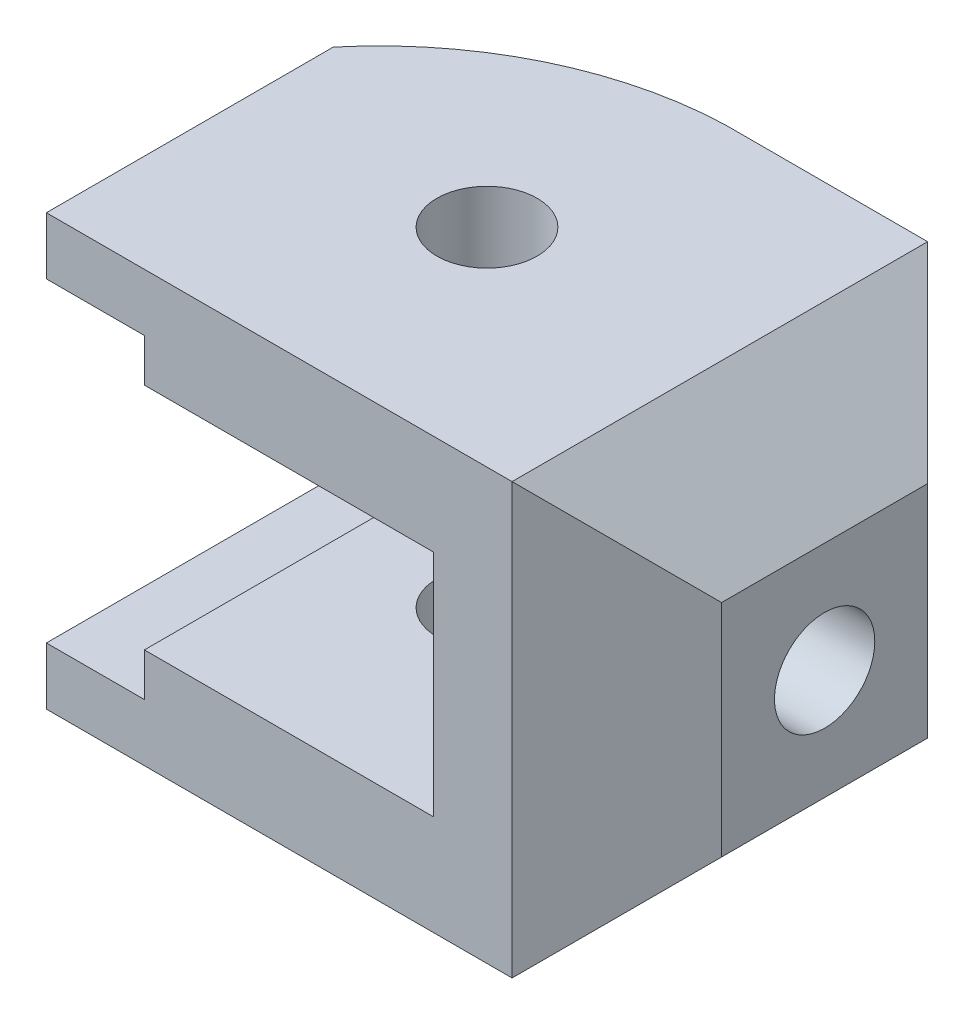
from build123d import *

# Parameters (mm, degrees)
BOSS_EXTRUDE1_DEPTH = 58
SKETCH5_R           = 7
CUT_EXTRUDE1_DEPTH  = 116.341103519
SKETCH7_R           = 7
CUT_EXTRUDE2_DEPTH  = 116.341103519
CUT_EXTRUDE3_DEPTH  = 116.341103519
CUT_EXTRUDE4_DEPTH  = 116.341103519


with BuildPart() as part:
    # Sketch1 → Boss-Extrude1 (new body)
    with BuildSketch(Plane.XY):
        Polygon((0, 0), (65, 0), (79.621417728, 14.621417728), (79.621417728, 45.378582272), (65, 60), (0, 60), (0, 52), (13.686014712, 52), (13.686014712, 46), (54, 46), (54, 14), (13.686014712, 14), (13.686014712, 8), (0, 8), align=None)
    extrude(amount=BOSS_EXTRUDE1_DEPTH)

    # Sketch5 → Cut-Extrude1 (cut, through all)
    with BuildSketch(Plane(origin=(79.621417728, 0, 0), x_dir=(0, 0, -1), z_dir=(1, 0, 0))):
        with Locations((-29, 30)):
            Circle(SKETCH5_R)
    extrude(amount=-CUT_EXTRUDE1_DEPTH, mode=Mode.SUBTRACT)

    # Sketch7 → Cut-Extrude2 (cut, through all)
    with BuildSketch(Plane(origin=(0, 60, 0), x_dir=(1, 0, 0), z_dir=(0, 1, 0))):
        with Locations(Location((32.5, -29, 0), (0, 0, 180))):
            Circle(SKETCH7_R)
    extrude(amount=-CUT_EXTRUDE2_DEPTH, mode=Mode.SUBTRACT)

    # Sketch9 → Cut-Extrude3 (cut, through all)
    with BuildSketch(Plane(origin=(0, 0, 0), x_dir=(1, 0, 0), z_dir=(0, 1, 0))):
        Polygon((65, 0), (79.621417728, 0), (79.621417728, -14.621417728), align=None)
        Polygon((65, -58), (79.621417728, -43.378582272), (79.621417728, -58), align=None)
    extrude(amount=CUT_EXTRUDE3_DEPTH, mode=Mode.SUBTRACT)

    # Sketch11 → Cut-Extrude4 (cut, through all)
    with BuildSketch(Plane(origin=(0, 60, 0), x_dir=(1, 0, 0), z_dir=(0, 1, 0))):
        with BuildLine():
            Line((36.71635628, 0), (0, 0))
            Line((0, 0), (0, -17.954880359))
            ThreePointArc((0, -17.954880359), (16.439804094, -5.054512065), (36.71635628, 0))
        make_face()
    extrude(amount=-CUT_EXTRUDE4_DEPTH, mode=Mode.SUBTRACT)


solid = part.part
